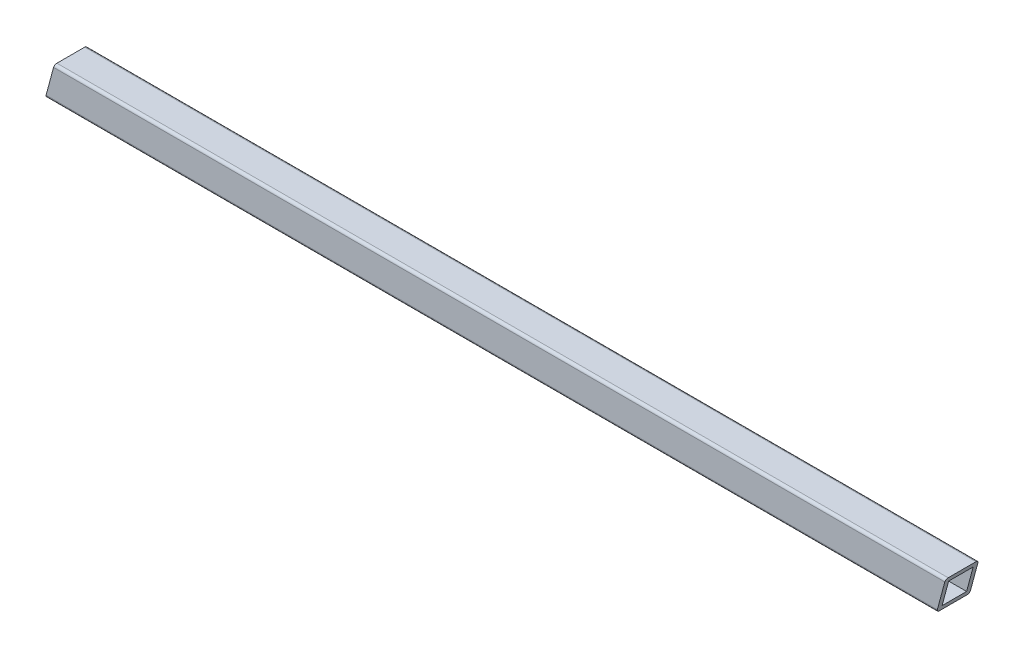
from build123d import *

# Parameters (mm, degrees)
SKETCH1_W           = 23.495
SKETCH1_H           = 23.495
BOSS_EXTRUDE1_DEPTH = 1320.8
SCALE2_SCALE_X      = 1
SCALE2_SCALE_Y      = 0.4
SCALE2_SCALE_Z      = 0.4
CUT_EXTRUDE1_DEPTH  = 1322.04802369
CUT_EXTRUDE2_DEPTH  = 1322.04802369


with BuildPart() as part:
    # Sketch1 → Boss-Extrude1 (new body)
    with BuildSketch(Plane(origin=(0, 0, 0), x_dir=(0, 0, -1), z_dir=(1, 0, 0))):
        with BuildLine():
            Line((0, 2.54), (0, 29.21))
            ThreePointArc((0, 29.21), (-0.743948776, 31.006051224), (-2.54, 31.75))
            Line((-2.54, 31.75), (-29.21, 31.75))
            ThreePointArc((-29.21, 31.75), (-31.006051224, 31.006051224), (-31.75, 29.21))
            Line((-31.75, 29.21), (-31.75, 2.54))
            ThreePointArc((-31.75, 2.54), (-31.006051224, 0.743948776), (-29.21, 0))
            Line((-29.21, 0), (-2.54, 0))
            ThreePointArc((-2.54, 0), (-0.743948776, 0.743948776), (0, 2.54))
        make_face()
        with Locations((-15.875, 15.875)):
            Rectangle(SKETCH1_W, SKETCH1_H, mode=Mode.SUBTRACT)
    extrude(amount=BOSS_EXTRUDE1_DEPTH)


with BuildPart() as part_1:
    # Scale2: scaled about (660.4, 15.875, 15.875)
    add(part.part.scale((SCALE2_SCALE_X, SCALE2_SCALE_Y, SCALE2_SCALE_Z), about=(660.4, 15.875, 15.875)))

    # Sketch3 → Cut-Extrude1 (cut, through all)
    with BuildSketch(Plane.XY.offset(22.225)):
        Polygon((877.40066618, 22.225), (873.997711436, 9.525), (851.266371854, 9.525), (851.266371854, 22.225), align=None)
    extrude(amount=-CUT_EXTRUDE1_DEPTH, mode=Mode.SUBTRACT)


with BuildPart() as cut_extrude1_kept_piece:
    # of the separate pieces the step leaves, the one the design keeps (cut_extrude1_pieces_kept)
    add(part_1.part.solids().sort_by_distance((877.128429801, 21.209, 9.525))[0])

    # Sketch4 → Cut-Extrude2 (cut, through all)
    with BuildSketch(Plane.XY.offset(22.225)):
        Polygon((1215.797045256, 9.525), (1320.8, 9.525), (1320.8, 22.225), (1219.2, 22.225), align=None)
    extrude(amount=-CUT_EXTRUDE2_DEPTH, mode=Mode.SUBTRACT)


solid = cut_extrude1_kept_piece.part
